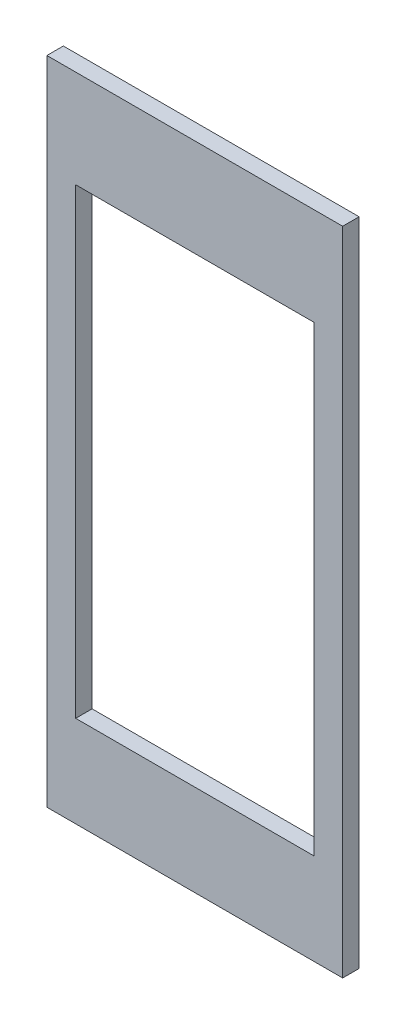
from build123d import *

# Parameters (mm, degrees)
SKETCH1_W           = 57.15
SKETCH1_H           = 125.809375
SKETCH1_W_2         = 46.0375
SKETCH1_H_2         = 89.296875
BOSS_EXTRUDE1_DEPTH = 1.5875


with BuildPart() as part:
    # Sketch1 → Boss-Extrude1 (new, symmetric)
    with BuildSketch(Plane.XY):
        Rectangle(SKETCH1_W, SKETCH1_H)
        with Locations((0, -0.5953125)):
            Rectangle(SKETCH1_W_2, SKETCH1_H_2, mode=Mode.SUBTRACT)
    extrude(amount=BOSS_EXTRUDE1_DEPTH, both=True)


solid = part.part
